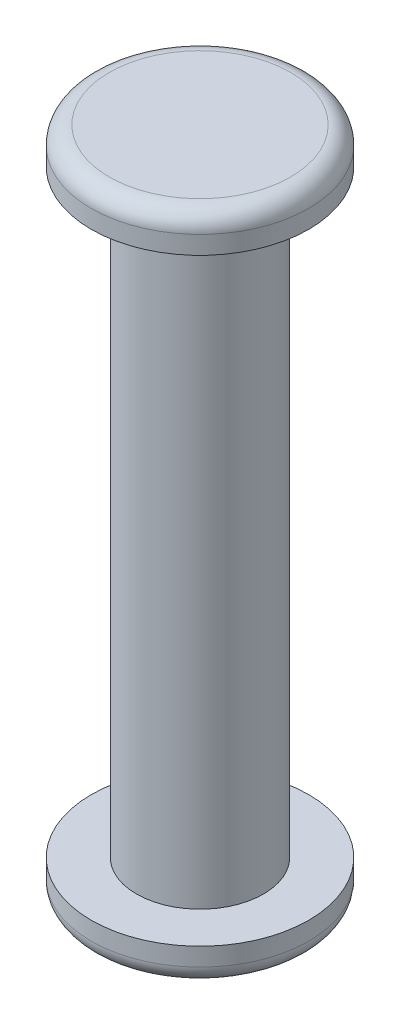
from build123d import *

# Parameters (mm, degrees)
SKETCH1_R           = 1.75
BOSS_EXTRUDE1_DEPTH = 16.5
SKETCH2_W           = 3
SKETCH2_H           = 1
FILLET1_R           = 0.5


with BuildPart() as part:
    # Sketch1 → Boss-Extrude1 (new body)
    with BuildSketch(Plane(origin=(0, 0, 0), x_dir=(1, 0, 0), z_dir=(0, 1, 0))):
        with Locations(Location((0, 0, 0), (0, 0, 270))):
            Circle(SKETCH1_R)
    extrude(amount=BOSS_EXTRUDE1_DEPTH)

    # Sketch2 → Revolve1 (revolve)
    with BuildSketch(Plane.XY, mode=Mode.PRIVATE) as revolve1_sk:
        with Locations((-1.5, 17)):
            Rectangle(SKETCH2_W, SKETCH2_H)
        with Locations((-1.5, -0.5)):
            Rectangle(SKETCH2_W, SKETCH2_H)
    revolve(revolve1_sk.sketch.rotate(Axis((0, 0, 0), (0, 1, 0)), 270), axis=Axis((0, 0, 0), (0, 1, 0)))

    # Fillet1
    fillet1_edges = [part.edges().sort_by_distance(p)[0] for p in [
        (0, -1, 3),
        (0, 17.5, 3),
    ]]
    fillet(fillet1_edges, radius=FILLET1_R)


solid = part.part
